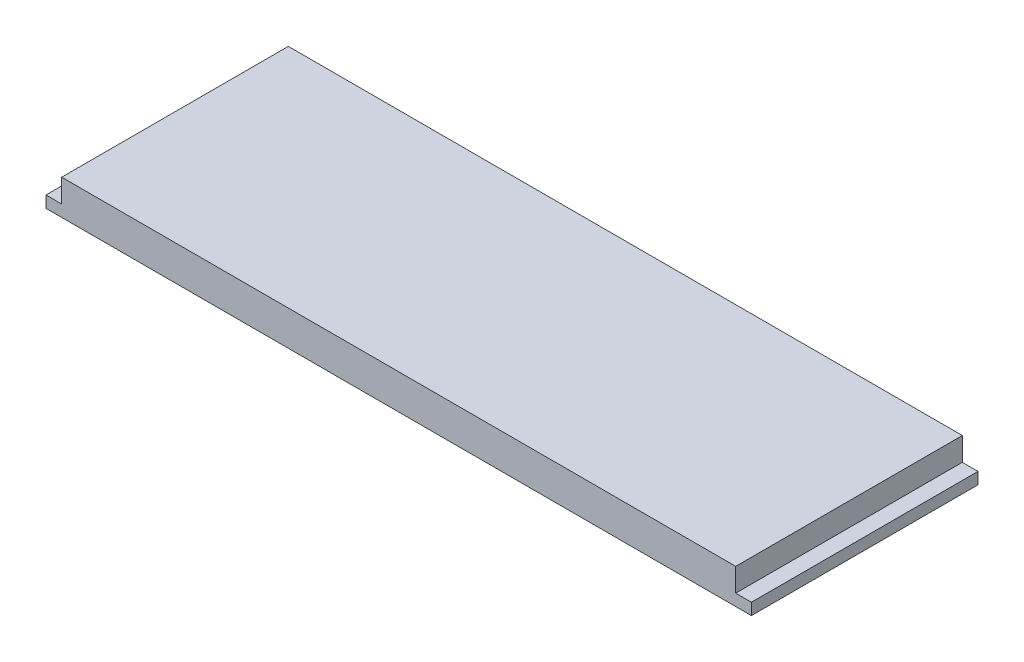
from build123d import *

# Parameters (mm, degrees)
SKETCH1_W           = 60.7
SKETCH1_H           = 19.5
BOSS_EXTRUDE1_DEPTH = 1
SKETCH2_W           = 58
SKETCH2_H           = 19.5
BOSS_EXTRUDE2_DEPTH = 2


with BuildPart() as part:
    # Sketch1 → Boss-Extrude1 (new body)
    with BuildSketch(Plane(origin=(0, 0, 0), x_dir=(1, 0, 0), z_dir=(0, 1, 0))):
        with Locations((30.35, -9.75)):
            Rectangle(SKETCH1_W, SKETCH1_H)
    extrude(amount=BOSS_EXTRUDE1_DEPTH)

    # Sketch2 → Boss-Extrude2 (add)
    with BuildSketch(Plane(origin=(0, 1, 0), x_dir=(1, 0, 0), z_dir=(0, 1, 0))):
        with Locations((30.35, -9.75)):
            Rectangle(SKETCH2_W, SKETCH2_H)
    extrude(amount=BOSS_EXTRUDE2_DEPTH)


solid = part.part
